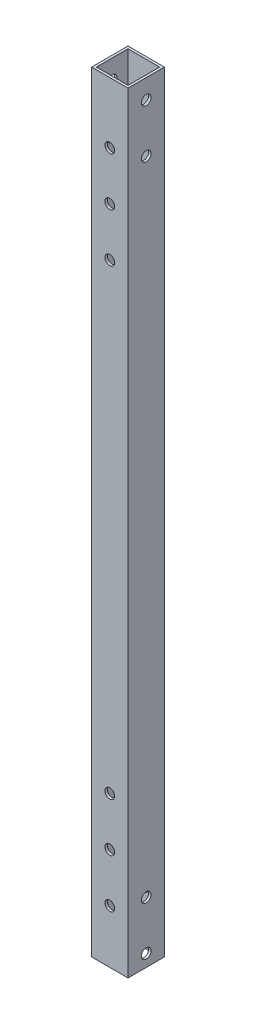
from build123d import *

# Parameters (mm, degrees)
SKETCH_1_W          = 15
SKETCH_1_H          = 15
SKETCH_1_W_2        = 13
SKETCH_1_H_2        = 13
EXTRUDE_1_DEPTH     = 320
SKETCH_3_R          = 2
CUT_EXTRUDE_2_DEPTH = 321.43915179
SKETCH_4_R          = 2
CUT_EXTRUDE_3_DEPTH = 321.43915179
SKETCH_7_W          = 15
SKETCH_7_H          = 3
CUT_EXTRUDE_6_DEPTH = 20


with BuildPart() as part:
    # 草图1 → 凸台-拉伸1 (new body)
    with BuildSketch(Plane(origin=(0, 0, 0), x_dir=(1, 0, 0), z_dir=(0, 1, 0))):
        Rectangle(SKETCH_1_W, SKETCH_1_H)
        Rectangle(SKETCH_1_W_2, SKETCH_1_H_2, mode=Mode.SUBTRACT)
    extrude(amount=EXTRUDE_1_DEPTH)

    # 草图3 → 切除-拉伸2 (cut, through all)
    with BuildSketch(Plane.XY.offset(7.5)):
        with Locations((0, 295)):
            Circle(SKETCH_3_R)
        with Locations((0, 275)):
            Circle(SKETCH_3_R)
        with Locations(Location((0, 45, 0), (0, 0, 180))):
            Circle(SKETCH_3_R)
        with Locations(Location((0, 25, 0), (0, 0, 180))):
            Circle(SKETCH_3_R)
        with Locations((0, 255)):
            Circle(SKETCH_3_R)
        with Locations(Location((0, 65, 0), (0, 0, 180))):
            Circle(SKETCH_3_R)
    extrude(amount=-CUT_EXTRUDE_2_DEPTH, mode=Mode.SUBTRACT)

    # 草图4 → 切除-拉伸3 (cut, through all)
    with BuildSketch(Plane.ZY.offset(7.5)):
        with Locations((0, 8)):
            Circle(SKETCH_4_R)
        with Locations((0, 28)):
            Circle(SKETCH_4_R)
        with Locations(Location((0, 292, 0), (0, 0, 180))):
            Circle(SKETCH_4_R)
        with Locations(Location((0, 312, 0), (0, 0, 180))):
            Circle(SKETCH_4_R)
    extrude(amount=-CUT_EXTRUDE_3_DEPTH, mode=Mode.SUBTRACT)

    # 草图7 → 切除-拉伸6 (cut)
    with BuildSketch(Plane(origin=(7.5, 0, 0), x_dir=(0, 0, -1), z_dir=(1, 0, 0))):
        with Locations((0, 1.5)):
            Rectangle(SKETCH_7_W, SKETCH_7_H)
    extrude(amount=-CUT_EXTRUDE_6_DEPTH, mode=Mode.SUBTRACT)


solid = part.part
